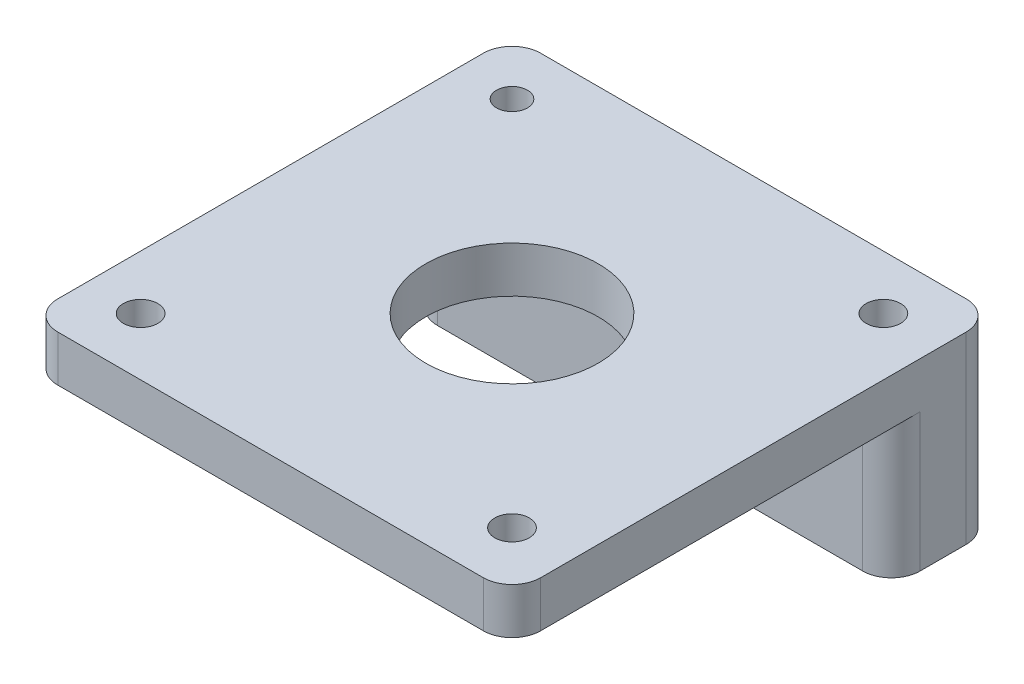
from build123d import *

# Parameters (mm, degrees)
SKETCH1_W           = 42
SKETCH1_H           = 9
BOSS_EXTRUDE1_DEPTH = 12
SKETCH2_W           = 42
SKETCH2_H           = 42
BOSS_EXTRUDE2_DEPTH = 4
FILLET1_R           = 2.5
FILLET2_R           = 2.5
FILLET3_R           = 2.5
FILLET4_R           = 2.5
FILLET5_R           = 2.5
FILLET6_R           = 2.5
SKETCH3_R           = 7.5
SKETCH3_R_2         = 1.5
SKETCH3_R_3         = 1.342252065
CUT_EXTRUDE1_DEPTH  = 20
SKETCH4_R           = 3
CUT_EXTRUDE2_DEPTH  = 5
SKETCH5_R           = 4
CUT_EXTRUDE3_DEPTH  = 9


with BuildPart() as part:
    # Sketch1 → Boss-Extrude1 (new body)
    with BuildSketch(Plane(origin=(0, 0, 0), x_dir=(1, 0, 0), z_dir=(0, 1, 0))):
        with Locations((21, 4.5)):
            Rectangle(SKETCH1_W, SKETCH1_H)
    extrude(amount=BOSS_EXTRUDE1_DEPTH)

    # Sketch2 → Boss-Extrude2 (add)
    with BuildSketch(Plane(origin=(0, 12, 0), x_dir=(1, 0, 0), z_dir=(0, 1, 0))):
        with Locations((21, -12)):
            Rectangle(SKETCH2_W, SKETCH2_H)
    extrude(amount=BOSS_EXTRUDE2_DEPTH)

    # Fillet1
    fillet1_edges = [part.edges().sort_by_distance(p)[0] for p in [
        (0, 14, 33),
    ]]
    fillet(fillet1_edges, radius=FILLET1_R)

    # Fillet2
    fillet2_edges = [part.edges().sort_by_distance(p)[0] for p in [
        (0, 8, -9),
    ]]
    fillet(fillet2_edges, radius=FILLET2_R)

    # Fillet3
    fillet3_edges = [part.edges().sort_by_distance(p)[0] for p in [
        (0, 6, 0),
    ]]
    fillet(fillet3_edges, radius=FILLET3_R)

    # Fillet4
    fillet4_edges = [part.edges().sort_by_distance(p)[0] for p in [
        (42, 14, 33),
    ]]
    fillet(fillet4_edges, radius=FILLET4_R)

    # Fillet5
    fillet5_edges = [part.edges().sort_by_distance(p)[0] for p in [
        (42, 6, 0),
    ]]
    fillet(fillet5_edges, radius=FILLET5_R)

    # Fillet6
    fillet6_edges = [part.edges().sort_by_distance(p)[0] for p in [
        (42, 8, -9),
    ]]
    fillet(fillet6_edges, radius=FILLET6_R)

    # Sketch3 → Cut-Extrude1 (cut)
    with BuildSketch(Plane(origin=(0, 16, 0), x_dir=(1, 0, 0), z_dir=(0, 1, 0))):
        with Locations(Location((20.85, -11.85, 0), (0, 0, 270))):
            Circle(SKETCH3_R)
        with Locations(Location((4.7, -28, 0), (0, 0, 270))):
            Circle(SKETCH3_R_2)
        with Locations(Location((37, -28, 0), (0, 0, 270))):
            Circle(SKETCH3_R_2)
        with Locations(Location((37, 4.3, 0), (0, 0, 270))):
            Circle(SKETCH3_R_2)
        with Locations(Location((4.7, 4.3, 0), (0, 0, 270))):
            Circle(SKETCH3_R_3)
    extrude(amount=-CUT_EXTRUDE1_DEPTH, mode=Mode.SUBTRACT)

    # Sketch4 → Cut-Extrude2 (cut)
    with BuildSketch(Plane.XZ):
        with Locations(Location((4.7, -4.3, 0), (0, 0, 270))):
            Circle(SKETCH4_R)
        with Locations(Location((37, -4.3, 0), (0, 0, 270))):
            Circle(SKETCH4_R)
    extrude(amount=-CUT_EXTRUDE2_DEPTH, mode=Mode.SUBTRACT)

    # Sketch5 → Cut-Extrude3 (cut)
    with BuildSketch(Plane(origin=(0, 0, -9), x_dir=(-1, 0, 0), z_dir=(0, 0, -1))):
        with Locations((-27, 8)):
            Circle(SKETCH5_R)
    extrude(amount=-CUT_EXTRUDE3_DEPTH, mode=Mode.SUBTRACT)


solid = part.part
